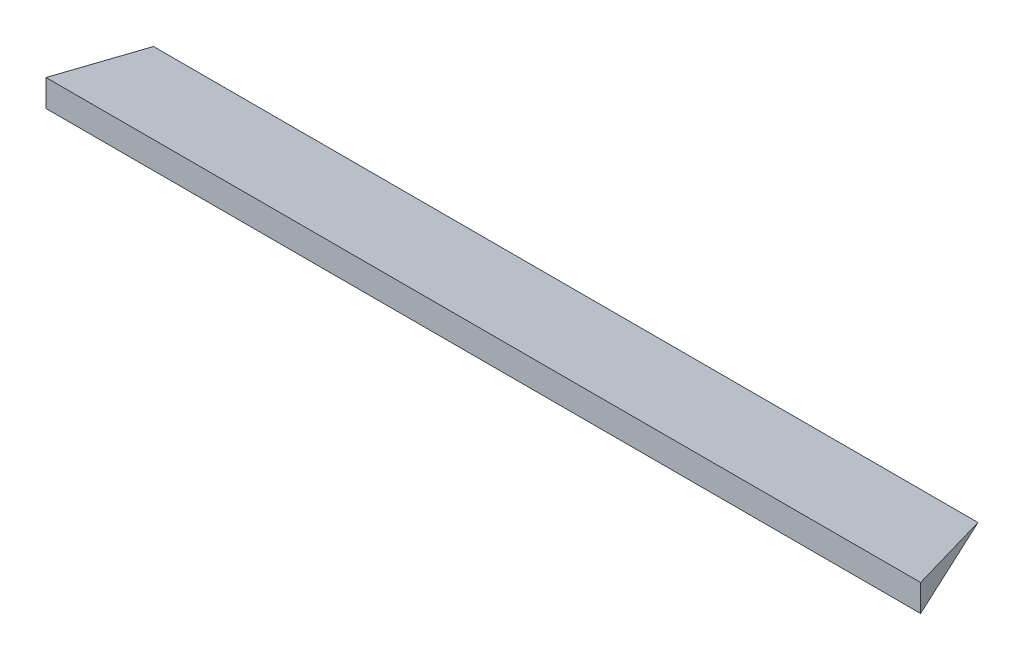
from build123d import *

# Parameters (mm, degrees)
BOSS_EXTRUDE1_DEPTH     = 310
CUT_EXTRUDE1_DEPTH      = 313.477736207
CUT_EXTRUDE1_DEPTH_BACK = 313.477736207


with BuildPart() as part:
    # Sketch1 → Boss-Extrude1 (new body)
    with BuildSketch(Plane(origin=(0, 0, 0), x_dir=(0, 0, -1), z_dir=(1, 0, 0))):
        Polygon((0, 0), (38.1, 0), (0, 9.525), align=None)
    extrude(amount=BOSS_EXTRUDE1_DEPTH)

    # Sketch3 → Cut-Extrude1 (cut, two sides: drawn at the far end of the back side and taken through both)
    with BuildSketch(Plane(origin=(0, 0, 0), x_dir=(1, 0, 0), z_dir=(0, 1, 0)).offset(-CUT_EXTRUDE1_DEPTH_BACK)):
        Polygon((310, 0), (292.233678224, 38.1), (310, 38.1), align=None)
    extrude(amount=CUT_EXTRUDE1_DEPTH + CUT_EXTRUDE1_DEPTH_BACK, mode=Mode.SUBTRACT)


solid = part.part
